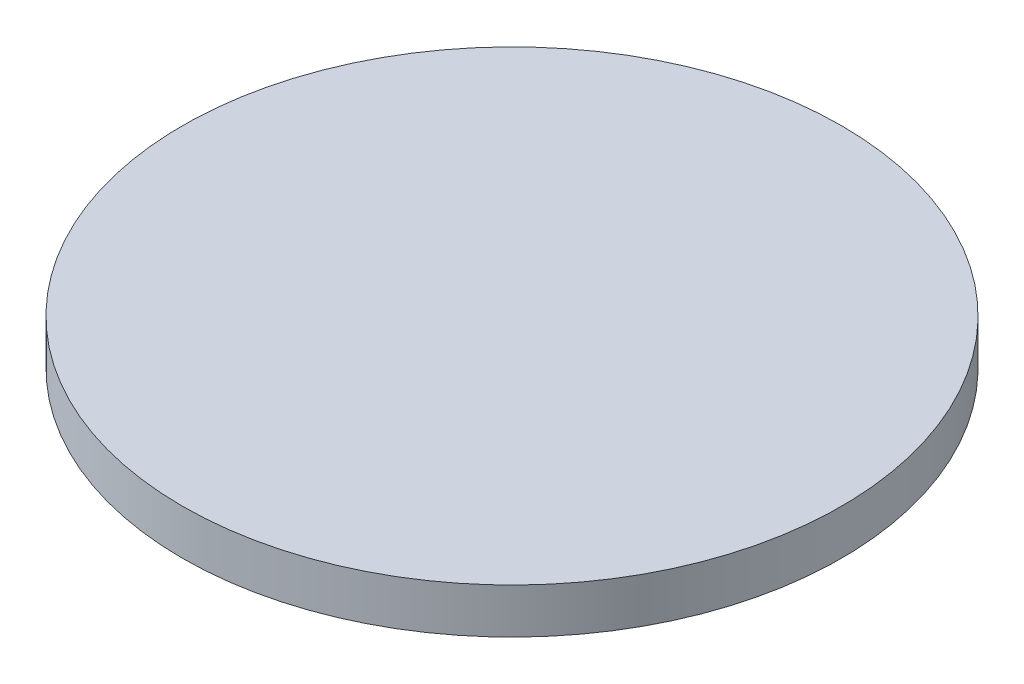
from build123d import *

# Parameters (mm, degrees)
SKETCH1_R           = 17.399
BOSS_EXTRUDE1_DEPTH = 2.38125


with BuildPart() as part:
    # Sketch1 → Boss-Extrude1 (new body)
    with BuildSketch(Plane(origin=(0, 0, 0), x_dir=(1, 0, 0), z_dir=(0, 1, 0))):
        with Locations(Location((0, 0, 0), (0, 0, 90))):
            Circle(SKETCH1_R)
    extrude(amount=BOSS_EXTRUDE1_DEPTH)


solid = part.part
